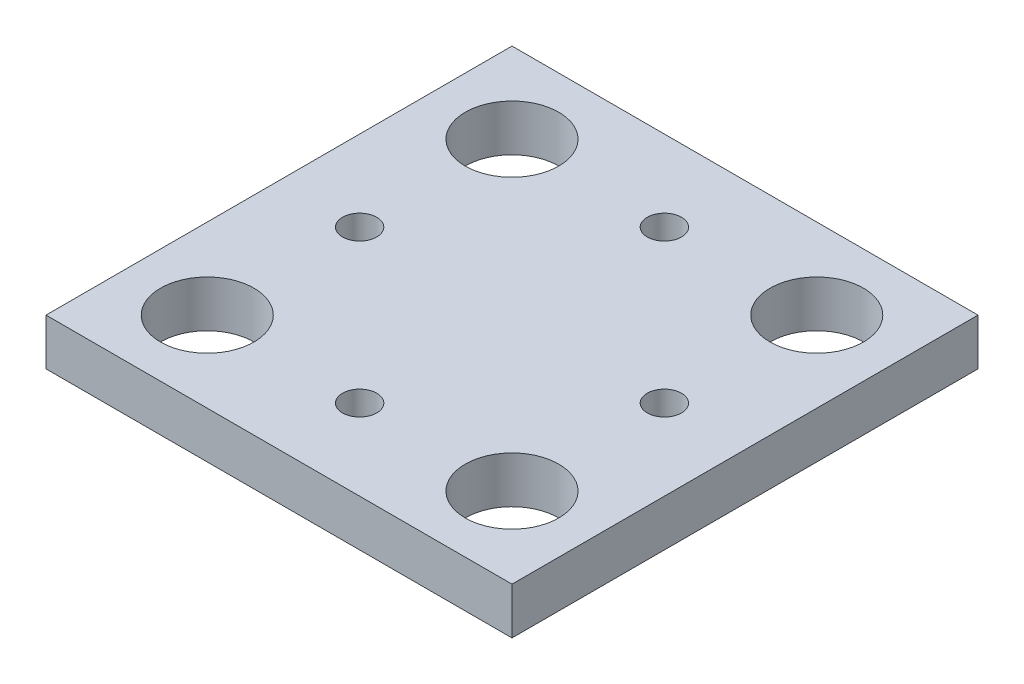
from build123d import *

# Parameters (mm, degrees)
SKETCH1_W               = 100
SKETCH1_H               = 100
BOSS_EXTRUDE1_DEPTH     = 10
CUT_EXTRUDE3_DEPTH      = 72.414284285
CUT_EXTRUDE3_DEPTH_BACK = 72.414284285
SKETCH3_R               = 10.025
SKETCH3_R_2             = 3.675


with BuildPart() as part:
    # Sketch1 → Boss-Extrude1 (new body)
    with BuildSketch(Plane(origin=(0, 0, 0), x_dir=(1, 0, 0), z_dir=(0, 1, 0))):
        Rectangle(SKETCH1_W, SKETCH1_H)
    extrude(amount=BOSS_EXTRUDE1_DEPTH)

    # Sketch3 → Cut-Extrude3 (cut, two sides: drawn at the far end of the back side and taken through both)
    with BuildSketch(Plane(origin=(0, 0, 0), x_dir=(1, 0, 0), z_dir=(0, 1, 0)).offset(-CUT_EXTRUDE3_DEPTH_BACK)):
        with Locations(Location((-32.7, 32.7, 0), (0, 0, 270))):
            Circle(SKETCH3_R)
        with Locations(Location((32.7, 32.7, 0), (0, 0, 270))):
            Circle(SKETCH3_R)
        with Locations(Location((32.7, -32.7, 0), (0, 0, 270))):
            Circle(SKETCH3_R)
        with Locations(Location((-32.7, -32.7, 0), (0, 0, 270))):
            Circle(SKETCH3_R)
        with Locations(Location((0, 32.7, 0), (0, 0, 270))):
            Circle(SKETCH3_R_2)
        with Locations(Location((32.7, 0, 0), (0, 0, 270))):
            Circle(SKETCH3_R_2)
        with Locations(Location((0, -32.7, 0), (0, 0, 270))):
            Circle(SKETCH3_R_2)
        with Locations(Location((-32.7, 0, 0), (0, 0, 270))):
            Circle(SKETCH3_R_2)
    extrude(amount=CUT_EXTRUDE3_DEPTH + CUT_EXTRUDE3_DEPTH_BACK, mode=Mode.SUBTRACT)


solid = part.part
